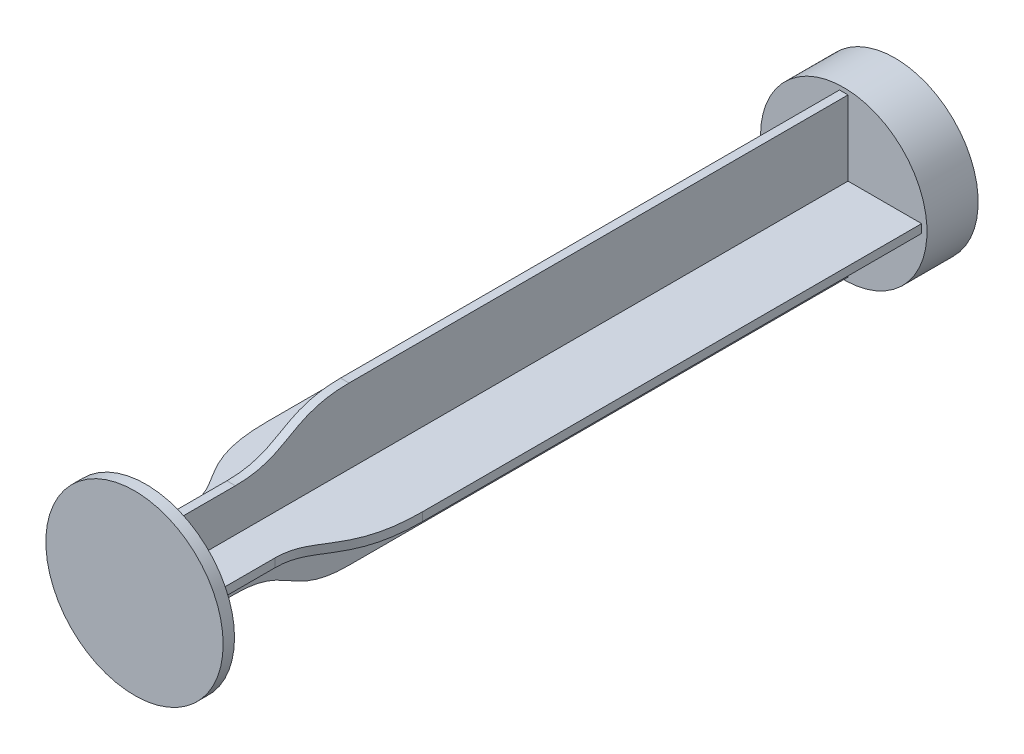
from build123d import *

# Parameters (mm, degrees)
SKETCH1_R           = 15.6
BOSS_EXTRUDE1_DEPTH = 2
BOSS_EXTRUDE3_DEPTH = 122.8
SKETCH11_R          = 14.65
BOSS_EXTRUDE4_DEPTH = 9
CUT_EXTRUDE1_DEPTH  = 1.5
CUT_EXTRUDE2_DEPTH  = 1.5


with BuildPart() as part:
    # Sketch1 → Boss-Extrude1 (new body)
    with BuildSketch(Plane.XY):
        Circle(SKETCH1_R)
    extrude(amount=BOSS_EXTRUDE1_DEPTH)

    # Sketch5 → Boss-Extrude3 (add)
    with BuildSketch(Plane(origin=(0, 0, -122.8), x_dir=(-1, 0, 0), z_dir=(0, 0, -1))):
        Polygon((0.75, 0.75), (13.7, 0.75), (13.7, -0.75), (0.75, -0.75), (0.75, -13.886326313), (-0.75, -13.886326313), (-0.75, -0.75), (-13.7, -0.75), (-13.7, 0.75), (-0.75, 0.75), (-0.75, 13.886326313), (0.75, 13.886326313), align=None)
    extrude(amount=-BOSS_EXTRUDE3_DEPTH)

    # Sketch11 → Boss-Extrude4 (add)
    with BuildSketch(Plane(origin=(0, 0, -122.8), x_dir=(-1, 0, 0), z_dir=(0, 0, -1))):
        Circle(SKETCH11_R)
    extrude(amount=BOSS_EXTRUDE4_DEPTH)

    # Sketch12 → Cut-Extrude1 (cut)
    with BuildSketch(Plane.ZY.offset(0.75)):
        with BuildLine():
            Line((0, 8.228019132), (-15, 8.228019132))
            add(Edge.make_bspline(
                [(-15, 8.228019132), (-24.489612622, 8.228019132), (-24.489612622, 13.886326313), (-35, 13.886326313)],
                knots=[0, 0, 0, 0, 1, 1, 1, 1], degree=3))
            Line((-35, 13.886326313), (-35, 19.520904109))
            Line((-35, 19.520904109), (0, 19.520904109))
            Line((0, 19.520904109), (0, 8.228019132))
        make_face()
        with BuildLine():
            Line((0, -19.520904109), (0, -8.228019132))
            Line((0, -8.228019132), (-15, -8.228019132))
            add(Edge.make_bspline(
                [(-15, -8.228019132), (-24.489612622, -8.228019132), (-24.489612622, -13.886326313), (-35, -13.886326313)],
                knots=[0, 0, 0, 0, 1, 1, 1, 1], degree=3))
            Line((-35, -13.886326313), (-35, -19.520904109))
            Line((-35, -19.520904109), (0, -19.520904109))
        make_face()
    extrude(amount=-CUT_EXTRUDE1_DEPTH, mode=Mode.SUBTRACT)

    # Sketch13 → Cut-Extrude2 (cut)
    with BuildSketch(Plane.XZ.offset(0.75)):
        with BuildLine():
            Line((7.75, 0), (7.75, -15))
            add(Edge.make_bspline(
                [(7.75, -15), (7.75, -21.966675068), (13.7, -21.966675068), (13.7, -35)],
                knots=[0, 0, 0, 0, 1, 1, 1, 1], degree=3))
            Line((13.7, -35), (21.110657524, -35))
            Line((21.110657524, -35), (21.110657524, 0))
            Line((21.110657524, 0), (7.75, 0))
        make_face()
        with BuildLine():
            Line((-21.110657524, 0), (-7.75, 0))
            Line((-7.75, 0), (-7.75, -15))
            add(Edge.make_bspline(
                [(-7.75, -15), (-7.75, -21.966675068), (-13.7, -21.966675068), (-13.7, -35)],
                knots=[0, 0, 0, 0, 1, 1, 1, 1], degree=3))
            Line((-13.7, -35), (-21.110657524, -35))
            Line((-21.110657524, -35), (-21.110657524, 0))
        make_face()
    extrude(amount=-CUT_EXTRUDE2_DEPTH, mode=Mode.SUBTRACT)


solid = part.part
